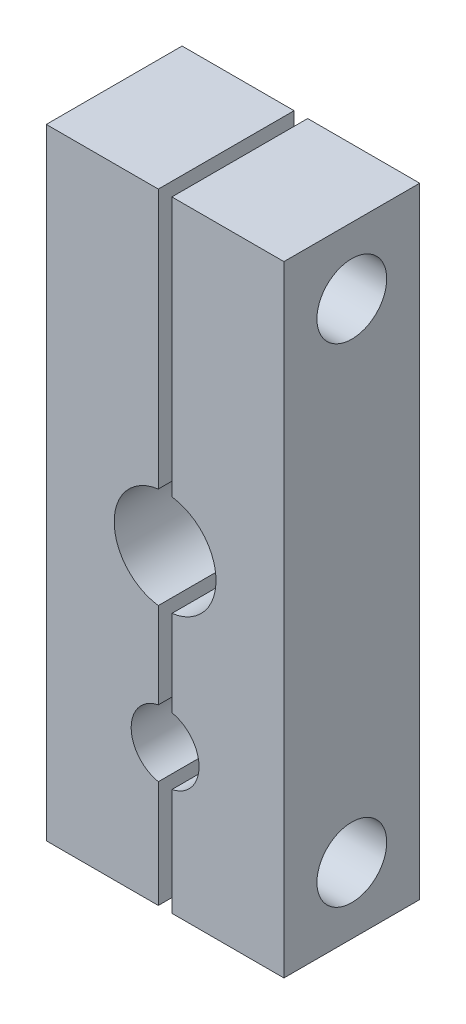
from build123d import *

# Parameters (mm, degrees)
SKETCH1_W               = 22.225
SKETCH1_H               = 58.027453668
SKETCH1_R               = 4.7625
SKETCH1_R_2             = 3.175
BOSS_EXTRUDE1_DEPTH     = 6.35
F_1_4_CLEARANCE_HOLE1_D = 6.5278
CUT_EXTRUDE1_DEPTH      = 32.711299265
CUT_EXTRUDE1_DEPTH_BACK = 32.711299265
SKETCH4_W               = 1.27
SKETCH4_H               = 62.020650964


with BuildPart() as part:
    # Sketch1 → Boss-Extrude1 (new, symmetric)
    with BuildSketch(Plane.XY):
        Rectangle(SKETCH1_W, SKETCH1_H)
        Circle(SKETCH1_R, mode=Mode.SUBTRACT)
        with Locations((0, -15.875)):
            Circle(SKETCH1_R_2, mode=Mode.SUBTRACT)
    extrude(amount=BOSS_EXTRUDE1_DEPTH, both=True)

    # 1/4 Clearance Hole1 (through all)
    with Locations(Plane.ZY.offset(11.1125)):
        with Locations((0, 22.8203125), (0, -22.8203125)):
            Hole(F_1_4_CLEARANCE_HOLE1_D / 2)

    # Sketch4 → Cut-Extrude1 (cut, two sides: drawn at the far end of the back side and taken through both)
    with BuildSketch(Plane.XY.offset(-CUT_EXTRUDE1_DEPTH_BACK)):
        Rectangle(SKETCH4_W, SKETCH4_H)
    extrude(amount=CUT_EXTRUDE1_DEPTH + CUT_EXTRUDE1_DEPTH_BACK, mode=Mode.SUBTRACT)


with BuildPart() as cut_extrude1_piece_1:
    # of the separate pieces the step leaves, piece 1, a body of its own (cut_extrude1_pieces)
    add(part.part.solids().sort_by_distance((-11.1125, -29.013726834, 6.35))[0])


with BuildPart() as cut_extrude1_piece_2:
    # of the separate pieces the step leaves, piece 2, a body of its own (cut_extrude1_pieces)
    add(part.part.solids().sort_by_distance((0.635, -29.013726834, 6.35))[0])


solid = Compound([cut_extrude1_piece_1.part, cut_extrude1_piece_2.part])
